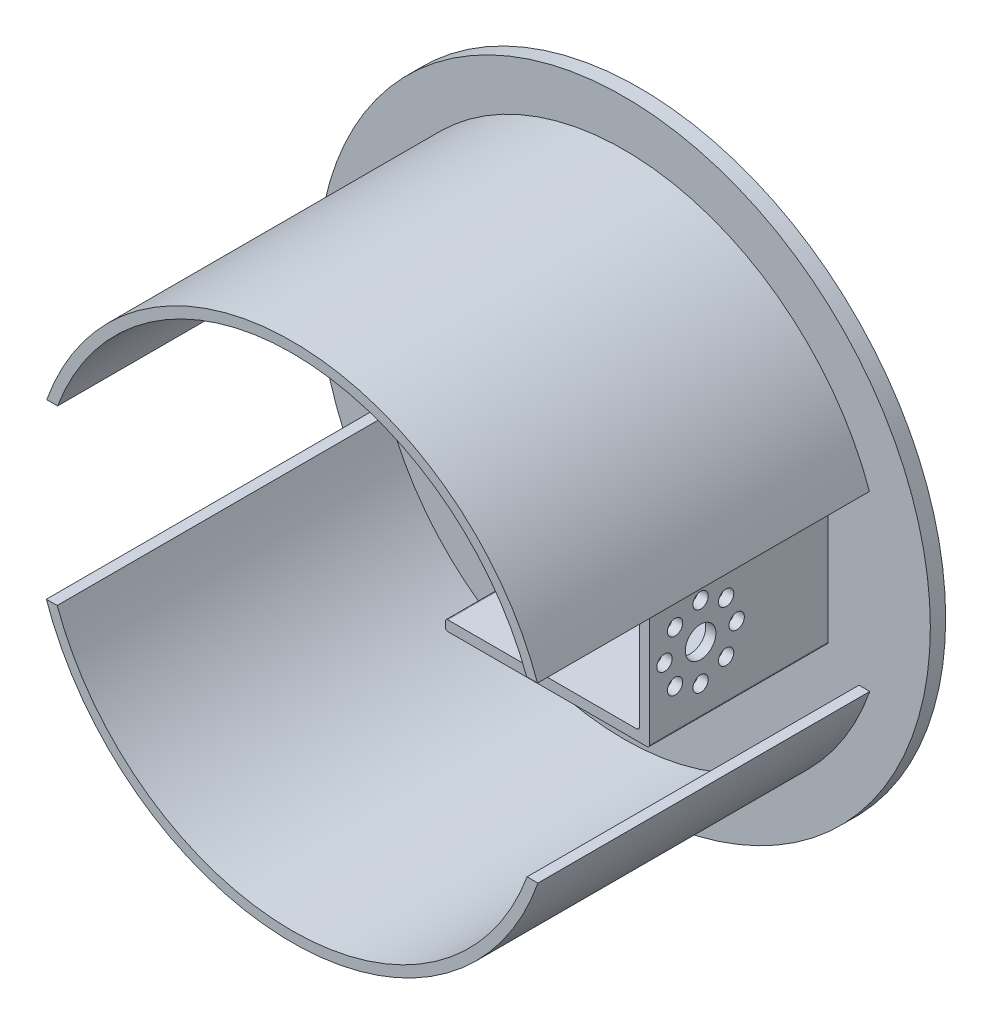
from build123d import *

# Parameters (mm, degrees)
SKETCH_3_R           = 48
EXTRUDE_2_DEPTH      = 3
SKETCH_4_R           = 3
CUT_EXTRUDE_1_DEPTH  = 3
EXTRUDE_3_DEPTH      = 35
SKETCH_6_R           = 3
SKETCH_6_R_2         = 1.5
CUT_EXTRUDE_2_DEPTH  = 35
SKETCH_7_R           = 1.55
CUT_EXTRUDE_5_DEPTH  = 35
SKETCH_8_R           = 2.05
CUT_EXTRUDE_6_DEPTH  = 10
SKETCH_9_R           = 1.55
CUT_EXTRUDE_7_DEPTH  = 10
SKETCH_10_W          = 35
SKETCH_10_H          = 25
EXTRUDE_4_DEPTH      = 2
SKETCH_11_R          = 3
SKETCH_11_R_2        = 1.5
CUT_EXTRUDE_8_DEPTH  = 2
EXTRUDE_START        = -3
SKETCH_12_R          = 49
SKETCH_12_R_2        = 48
EXTRUDE_5_DEPTH      = 3
SKETCH_14_R          = 51
SKETCH_14_R_2        = 49
EXTRUDE_6_DEPTH      = 65
SKETCH_15_R          = 51
SKETCH_15_R_2        = 49
EXTRUDE_7_DEPTH      = 3
SKETCH_16_R          = 60
SKETCH_16_R_2        = 51
EXTRUDE_9_DEPTH      = 3
SKETCH_19_W          = 65
SKETCH_19_H          = 33.883358742
CUT_EXTRUDE_9_DEPTH  = 135.996296245
SKETCH_21_W          = 65
SKETCH_21_H          = 33.883358742
CUT_EXTRUDE_10_DEPTH = 110.854449159


with BuildPart() as part:
    # 草图3 → 凸台-拉伸2 (new body)
    with BuildSketch(Plane.XY):
        Circle(SKETCH_3_R)
    extrude(amount=EXTRUDE_2_DEPTH)

    # 草图4 → 切除-拉伸1 (cut)
    with BuildSketch(Plane.XY.offset(3)):
        Circle(SKETCH_4_R)
    extrude(amount=-CUT_EXTRUDE_1_DEPTH, mode=Mode.SUBTRACT)

    # 草图5 → 凸台-拉伸3 (add)
    with BuildSketch(Plane.XY.offset(3)):
        with BuildLine():
            ThreePointArc((0, 12.5), (0.146446609, 12.853553391), (0.5, 13))
            Line((0.5, 13), (39.5, 13))
            ThreePointArc((39.5, 13), (39.853553391, 12.853553391), (40, 12.5))
            Line((40, 12.5), (40, -12.5))
            ThreePointArc((40, -12.5), (39.853553391, -12.853553391), (39.5, -13))
            Line((39.5, -13), (0.5, -13))
            ThreePointArc((0.5, -13), (0.146446609, -12.853553391), (0, -12.5))
            Line((0, -12.5), (0, -11.5))
            ThreePointArc((0, -11.5), (0.146446609, -11.146446609), (0.5, -11))
            Line((0.5, -11), (37.5, -11))
            ThreePointArc((37.5, -11), (37.853553391, -10.853553391), (38, -10.5))
            Line((38, -10.5), (38, 0))
            Line((38, 0), (38, 10.5))
            ThreePointArc((38, 10.5), (37.853553391, 10.853553391), (37.5, 11))
            Line((37.5, 11), (0.5, 11))
            ThreePointArc((0.5, 11), (0.146446609, 11.146446609), (0, 11.5))
            Line((0, 11.5), (0, 12.5))
        make_face()
    extrude(amount=EXTRUDE_3_DEPTH)

    # 草图6 → 切除-拉伸2 (cut)
    with BuildSketch(Plane(origin=(40, 0, 0), x_dir=(0, 0, -1), z_dir=(1, 0, 0))):
        with Locations((-25, 0)):
            Circle(SKETCH_6_R)
        with Locations((-20, -5)):
            Circle(SKETCH_6_R_2)
        with Locations((-20, 5)):
            Circle(SKETCH_6_R_2)
        with Locations((-30, -5)):
            Circle(SKETCH_6_R_2)
        with Locations((-30, 5)):
            Circle(SKETCH_6_R_2)
    extrude(amount=-CUT_EXTRUDE_2_DEPTH, mode=Mode.SUBTRACT)

    # 草图7 → 切除-拉伸5 (cut)
    with BuildSketch(Plane.XY.offset(3)):
        with Locations((-35, 0)):
            Circle(SKETCH_7_R)
        with Locations((-24.748737342, 24.748737342)):
            Circle(SKETCH_7_R)
        with Locations((0, 35)):
            Circle(SKETCH_7_R)
        with Locations((24.748737342, 24.748737342)):
            Circle(SKETCH_7_R)
        with Locations((35, 0)):
            Circle(SKETCH_7_R)
        with Locations((24.748737342, -24.748737342)):
            Circle(SKETCH_7_R)
        with Locations((0, -35)):
            Circle(SKETCH_7_R)
        with Locations((-24.748737342, -24.748737342)):
            Circle(SKETCH_7_R)
    extrude(amount=-CUT_EXTRUDE_5_DEPTH, mode=Mode.SUBTRACT)

    # 草图8 → 切除-拉伸6 (cut)
    with BuildSketch(Plane.XY.offset(3)):
        with Locations((0, 35)):
            Circle(SKETCH_8_R)
        with Locations((24.748737342, 24.748737342)):
            Circle(SKETCH_8_R)
        with Locations((35, 0)):
            Circle(SKETCH_8_R)
        with Locations((24.748737342, -24.748737342)):
            Circle(SKETCH_8_R)
        with Locations((0, -35)):
            Circle(SKETCH_8_R)
        with Locations((-24.748737342, -24.748737342)):
            Circle(SKETCH_8_R)
        with Locations((-35, 0)):
            Circle(SKETCH_8_R)
        with Locations((-24.748737342, 24.748737342)):
            Circle(SKETCH_8_R)
    extrude(amount=-CUT_EXTRUDE_6_DEPTH, mode=Mode.SUBTRACT)

    # 草图9 → 切除-拉伸7 (cut)
    with BuildSketch(Plane.XY.offset(3)):
        with Locations((-5, 5)):
            Circle(SKETCH_9_R)
        with Locations((5, 5)):
            Circle(SKETCH_9_R)
        with Locations((5, -5)):
            Circle(SKETCH_9_R)
        with Locations((-5, -5)):
            Circle(SKETCH_9_R)
    extrude(amount=-CUT_EXTRUDE_7_DEPTH, mode=Mode.SUBTRACT)

    # 草图10 → 凸台-拉伸4 (add)
    with BuildSketch(Plane(origin=(40, 0, 0), x_dir=(0, 0, -1), z_dir=(1, 0, 0))):
        with Locations((-20.5, 0)):
            Rectangle(SKETCH_10_W, SKETCH_10_H)
    extrude(amount=-EXTRUDE_4_DEPTH)

    # 草图11 → 切除-拉伸8 (cut)
    with BuildSketch(Plane(origin=(40, 0, 0), x_dir=(0, 0, -1), z_dir=(1, 0, 0))):
        with Locations((-28, 0)):
            Circle(SKETCH_11_R)
        with Locations((-33, 5)):
            Circle(SKETCH_11_R_2)
        with Locations((-28, 7.071067812)):
            Circle(SKETCH_11_R_2)
        with Locations((-23, 5)):
            Circle(SKETCH_11_R_2)
        with Locations((-20.928932188, 0)):
            Circle(SKETCH_11_R_2)
        with Locations((-23, -5)):
            Circle(SKETCH_11_R_2)
        with Locations((-28, -7.071067812)):
            Circle(SKETCH_11_R_2)
        with Locations((-33, -5)):
            Circle(SKETCH_11_R_2)
        with Locations((-35.071067812, 0)):
            Circle(SKETCH_11_R_2)
    extrude(amount=-CUT_EXTRUDE_8_DEPTH, mode=Mode.SUBTRACT)

    # 草图12 → 凸台-拉伸5 (add)
    with BuildSketch(Plane.XY.offset(3).offset(EXTRUDE_START)):
        Circle(SKETCH_12_R)
        Circle(SKETCH_12_R_2, mode=Mode.SUBTRACT)
    extrude(amount=EXTRUDE_5_DEPTH)



with BuildPart() as body_2:
    # 草图14 → 凸台-拉伸6 (new body)
    with BuildSketch(Plane.XY.offset(3)):
        Circle(SKETCH_14_R)
        Circle(SKETCH_14_R_2, mode=Mode.SUBTRACT)
    extrude(amount=EXTRUDE_6_DEPTH)


with BuildPart() as part_1:
    add(part.part)

    add(body_2.part)  # 凸台-拉伸7 merges body 2
    # 草图15 → 凸台-拉伸7 (add)
    with BuildSketch(Plane(origin=(0, 0, 0), x_dir=(-1, 0, 0), z_dir=(0, 0, -1))):
        Circle(SKETCH_15_R)
        with Locations(Location((0, 0, 0), (0, 0, 180))):
            Circle(SKETCH_15_R_2, mode=Mode.SUBTRACT)
    extrude(amount=-EXTRUDE_7_DEPTH)

    # 草图16 → 凸台-拉伸9 (add)
    with BuildSketch(Plane(origin=(0, 0, 0), x_dir=(-1, 0, 0), z_dir=(0, 0, -1))):
        Circle(SKETCH_16_R)
        Circle(SKETCH_16_R_2, mode=Mode.SUBTRACT)
    extrude(amount=-EXTRUDE_9_DEPTH)

    # 草图19 → 切除-拉伸9 (cut, through all)
    with BuildSketch(Plane(origin=(40, 0, 0), x_dir=(0, 0, -1), z_dir=(1, 0, 0))):
        with Locations((-35.5, 0.112944529)):
            Rectangle(SKETCH_19_W, SKETCH_19_H)
    extrude(amount=CUT_EXTRUDE_9_DEPTH, mode=Mode.SUBTRACT)

    # 草图21 → 切除-拉伸10 (cut, through all)
    with BuildSketch(Plane.ZY.offset(2)):
        with Locations((35.5, 0.112944529)):
            Rectangle(SKETCH_21_W, SKETCH_21_H)
    extrude(amount=CUT_EXTRUDE_10_DEPTH, mode=Mode.SUBTRACT)


solid = part_1.part
